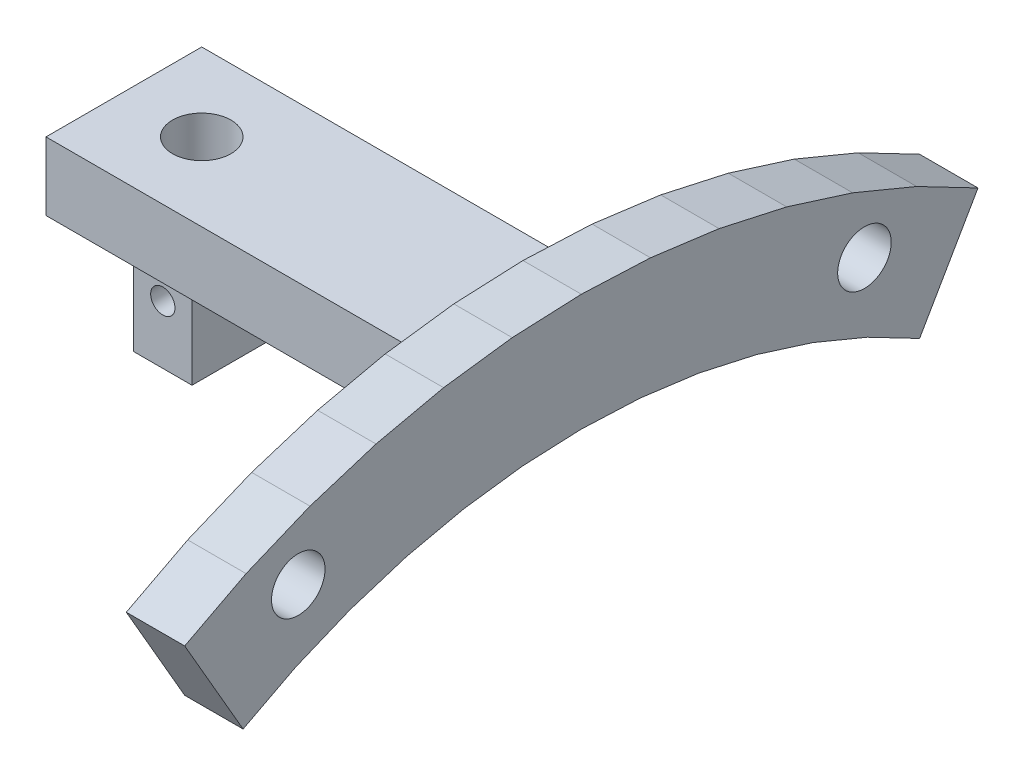
from build123d import *

# Parameters (mm, degrees)
FOOT_DEPTH                     = 6
RISER_SKETCH_W                 = 41
RISER_SKETCH_H                 = 7
RISER_DEPTH                    = 8
TAB_SKETCH_W                   = 6
TAB_SKETCH_H                   = 11.6
PUSHROD_TAB_DEPTH              = 4
PIN_HOLE_SKETCH_W              = 3
PIN_HOLE_SKETCH_H              = 7
BALL_JOINT_HOLE_SKETCH_R       = 1.25
BALL_JOINT_HOLE_DEPTH          = 5
FOOT_BOLT_HOLE_22_5_SKETCH_R   = 2.75
FOOT_BOLT_HOLE_22_5_DEPTH      = 6
FOOT_BOLT_HOLE_22_5_SKETCH_2_R = 2.75
FOOT_BOLT_HOLE_22_5_2_DEPTH    = 6


with BuildPart() as part:
    # Foot Sketch → Foot (new body)
    with BuildSketch(Plane(origin=(-9, 0, 0), x_dir=(0, 0, -1), z_dir=(1, 0, 0))):
        Polygon((-40.75, 70.581070408), (-34.443388332, 73.864084643), (-27.874641681, 76.584948594), (-21.093752176, 78.722954843), (-14.15232648, 80.26183187), (-7.103193034, 81.189867894), (0, 81.5), (7.103193034, 81.189867894), (14.15232648, 80.26183187), (21.093752176, 78.722954843), (27.874641681, 76.584948594), (34.443388332, 73.864084643), (40.75, 70.581070408), (34.75, 60.188765563), (29.371969191, 62.988391199), (23.770399961, 65.308637145), (17.987923635, 67.131844927), (12.068548348, 68.444138834), (6.057324121, 69.235531517), (0, 69.5), (-6.057324121, 69.235531517), (-12.068548348, 68.444138834), (-17.987923635, 67.131844927), (-23.770399961, 65.308637145), (-29.371969191, 62.988391199), (-34.75, 60.188765563), align=None)
    extrude(amount=-FOOT_DEPTH)

    # Riser Sketch → Riser (add, symmetric)
    with BuildSketch(Plane.XY):
        with Locations((-35.5, 72.5)):
            Rectangle(RISER_SKETCH_W, RISER_SKETCH_H)
    extrude(amount=RISER_DEPTH, both=True)

    # Tab Sketch → Pushrod Tab (add, symmetric)
    with BuildSketch(Plane.XY):
        with Locations((-48, 63.2)):
            Rectangle(TAB_SKETCH_W, TAB_SKETCH_H)
    extrude(amount=PUSHROD_TAB_DEPTH, both=True)

    # Pin Hole Sketch → Pin Hole (revolve, cut)
    with BuildSketch(Plane.XY, mode=Mode.PRIVATE) as pin_hole_sk:
        with Locations((-46.5, 73.5)):
            Rectangle(PIN_HOLE_SKETCH_W, PIN_HOLE_SKETCH_H)
    revolve(pin_hole_sk.sketch.rotate(Axis((-48, 59, 0), (0, 1, 0)), 90), axis=Axis((-48, 59, 0), (0, 1, 0)), mode=Mode.SUBTRACT)

    # Ball Joint Hole Sketch → Ball Joint Hole (cut, symmetric)
    with BuildSketch(Plane.XY):
        with Locations((-48, 63.4)):
            Circle(BALL_JOINT_HOLE_SKETCH_R)
    extrude(amount=BALL_JOINT_HOLE_DEPTH, both=True, mode=Mode.SUBTRACT)

    # Foot Bolt Hole _22.5 Sketch → Foot Bolt Hole _22.5 (cut)
    with BuildSketch(Plane(origin=(-9, 0, 0), x_dir=(0, 0, -1), z_dir=(1, 0, 0))):
        with Locations((29.08394086, 70.214844471)):
            Circle(FOOT_BOLT_HOLE_22_5_SKETCH_R)
    extrude(amount=-FOOT_BOLT_HOLE_22_5_DEPTH, mode=Mode.SUBTRACT)

    # Foot Bolt Hole -22.5 Sketch 2 → Foot Bolt Hole -22.5 2 (cut)
    with BuildSketch(Plane(origin=(-9, 0, 0), x_dir=(0, 0, -1), z_dir=(1, 0, 0))):
        with Locations((-29.08394086, 70.214844471)):
            Circle(FOOT_BOLT_HOLE_22_5_SKETCH_2_R)
    extrude(amount=-FOOT_BOLT_HOLE_22_5_2_DEPTH, mode=Mode.SUBTRACT)


solid = part.part
